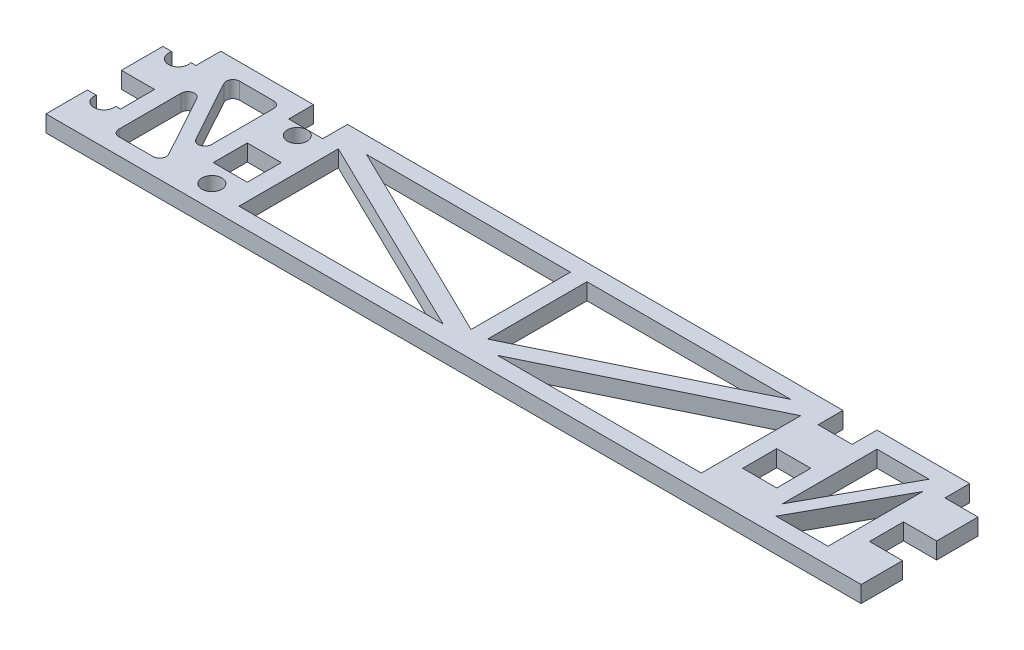
from build123d import *

# Parameters (mm, degrees)
SKETCH1_W                 = 6.5278
SKETCH1_H                 = 6.5278
BOSS_EXTRUDE1_DEPTH       = 3.175
F_6_CLEARANCE_HOLE1_D     = 3.7973
F_6_CLEARANCE_HOLE1_DEPTH = 6.35
F_6_CLEARANCE_HOLE1_TIP   = 1.140824014
FILLET1_R                 = 1.27


with BuildPart() as part:
    # Sketch1 → Boss-Extrude1 (new body)
    with BuildSketch(Plane(origin=(0, 0, 0), x_dir=(1, 0, 0), z_dir=(0, 1, 0))):
        Polygon((110.3249, 27.1653), (15.3289, 27.1653), (15.3289, 22.4028), (8.8011, 22.4028), (8.8011, 27.1653), (-8.9789, 27.1653), (-8.9789, 22.4028), (-15.3289, 22.4028), (-15.3289, 14.4653), (-8.9789, 14.4653), (-8.9789, 7.9375), (-15.3289, 7.9375), (-15.3289, 0), (140.9827, 0), (140.9827, 7.9375), (134.6327, 7.9375), (134.6327, 14.4653), (140.9827, 14.4653), (140.9827, 22.4028), (134.6327, 22.4028), (134.6327, 27.1653), (116.8527, 27.1653), (116.8527, 22.4028), (110.3249, 22.4028), align=None)
        Polygon((-5.8039, 3.175), (-5.8039, 21.351740689), (4.177226675, 3.175), align=None, mode=Mode.SUBTRACT)
        with Locations((12.065, 11.2014)):
            Rectangle(SKETCH1_W, SKETCH1_H, mode=Mode.SUBTRACT)
        Polygon((18.5039, 3.175), (18.5039, 22.224503319), (57.614076125, 3.175), align=None, mode=Mode.SUBTRACT)
        Polygon((107.1499, 3.175), (68.039723875, 3.175), (107.1499, 22.224503319), align=None, mode=Mode.SUBTRACT)
        with Locations((113.5888, 11.2014)):
            Rectangle(SKETCH1_W, SKETCH1_H, mode=Mode.SUBTRACT)
        Polygon((-4.355026675, 23.9903), (5.6261, 23.9903), (5.6261, 5.813559311), align=None, mode=Mode.SUBTRACT)
        Polygon((22.129223875, 23.9903), (61.2394, 23.9903), (61.2394, 4.940796681), align=None, mode=Mode.SUBTRACT)
        Polygon((64.4144, 4.940796681), (64.4144, 23.9903), (103.524576125, 23.9903), align=None, mode=Mode.SUBTRACT)
        Polygon((120.0277, 23.9903), (130.008826675, 23.9903), (120.0277, 5.813559311), align=None, mode=Mode.SUBTRACT)
        Polygon((131.4577, 21.351740689), (131.4577, 3.175), (121.476573325, 3.175), align=None, mode=Mode.SUBTRACT)
    extrude(amount=BOSS_EXTRUDE1_DEPTH)

    # #6 Clearance Hole1
    with Locations(Plane(origin=(11.855385862, 0, -6.482820987), x_dir=(-1, 0, 0), z_dir=(0, -1, 0))):
        with Locations((-0.507300427, 14.014979013), (-0.298514138, -2.158470987), (23.622699573, 1.063018674), (23.622699573, 15.350518674)):
            Hole(F_6_CLEARANCE_HOLE1_D / 2, depth=F_6_CLEARANCE_HOLE1_DEPTH)
            with Locations((0, 0, -(F_6_CLEARANCE_HOLE1_DEPTH + F_6_CLEARANCE_HOLE1_TIP / 2))):  # 118° drill point
                Cone(0, F_6_CLEARANCE_HOLE1_D / 2, F_6_CLEARANCE_HOLE1_TIP, mode=Mode.SUBTRACT)

    # Fillet1
    fillet1_edges = [part.edges().sort_by_distance(p)[0] for p in [
        (-5.8039, 1.5875, -21.351740689),
        (-5.8039, 1.5875, -3.175),
        (4.177226675, 1.5875, -3.175),
        (5.6261, 1.5875, -5.813559311),
        (5.6261, 1.5875, -23.9903),
        (-4.355026675, 1.5875, -23.9903),
    ]]
    fillet(fillet1_edges, radius=FILLET1_R)


solid = part.part
